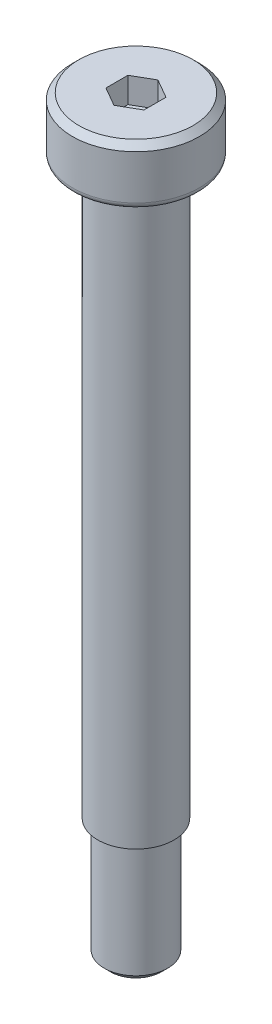
from build123d import *

# Parameters (mm, degrees)
CUT_EXTRUDE1_DEPTH = 2
CHAMFER1_SIZE      = 0.5
FILLET1_R          = 0.5
CHAMFER2_SIZE      = 0.5


with BuildPart() as part:
    # Sketch1 → Revolve1 (revolve)
    with BuildSketch(Plane.XY, mode=Mode.PRIVATE) as revolve1_sk:
        Polygon((0, 0), (5, 0), (5, -4.5), (2.75, -4.5), (2.75, -4.75), (3, -4.75), (3, -49.5), (2.5, -49.5), (2.5, -59), (0, -59), align=None)
    revolve(revolve1_sk.sketch.rotate(Axis((0, 5, 0), (0, -1, 0)), 180), axis=Axis((0, 5, 0), (0, -1, 0)))

    # Sketch2 → Cut-Extrude1 (cut)
    with BuildSketch(Plane(origin=(0, 0, 0), x_dir=(1, 0, 0), z_dir=(0, 1, 0))):
        Polygon((0, -1.732050808), (1.5, -0.866025404), (1.5, 0.866025404), (0, 1.732050808), (-1.5, 0.866025404), (-1.5, -0.866025404), align=None)
    extrude(amount=-CUT_EXTRUDE1_DEPTH, mode=Mode.SUBTRACT)

    # Chamfer1
    chamfer1_edges = [part.edges().sort_by_distance(p)[0] for p in [
        (5, 0, 0),
    ]]
    chamfer(chamfer1_edges, length=CHAMFER1_SIZE)

    # Fillet1
    fillet1_edges = [part.edges().sort_by_distance(p)[0] for p in [
        (5, -4.5, 0),
    ]]
    fillet(fillet1_edges, radius=FILLET1_R)

    # Chamfer2
    chamfer2_edges = [part.edges().sort_by_distance(p)[0] for p in [
        (2.5, -59, 0),
    ]]
    chamfer(chamfer2_edges, length=CHAMFER2_SIZE)


solid = part.part
